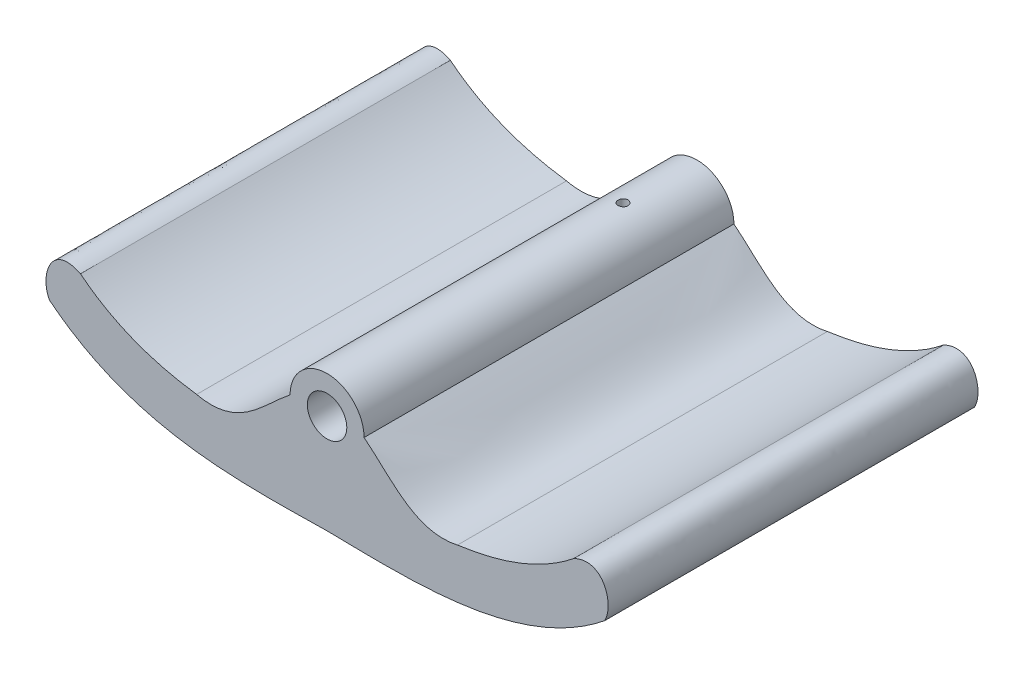
from build123d import *

# Parameters (mm, degrees)
SKETCH1_R           = 4
BOSS_EXTRUDE1_DEPTH = 75
SKETCH2_R           = 1
CUT_EXTRUDE1_DEPTH  = 75


with BuildPart() as part:
    # Sketch1 → Boss-Extrude1 (new body)
    with BuildSketch(Plane.XY):
        with BuildLine():
            ThreePointArc((7.5, 0), (0, 7.5), (-7.5, 0))
            add(Edge.make_bspline(
                [(-7.5, 0), (-13.133413819, -4.461912435), (-17.767441975, -11.345900192), (-26.448408985, -9.404150694)],
                knots=[0, 0, 0, 0, 1, 1, 1, 1], degree=3))
            add(Edge.make_bspline(
                [(-26.448408985, -9.404150694), (-34.892519394, -8.241593996), (-42.998591866, -5.63640498), (-50, 0)],
                knots=[0.508532521, 0.508532521, 0.508532521, 0.508532521, 1, 1, 1, 1], degree=3))
            add(Edge.make_bspline(
                [(-56.270853764, -7.789505316), (-58.317034017, -4.120672935), (-55.963516082, 2.956586768), (-50, 0)],
                knots=[0, 0, 0, 0, 1, 1, 1, 1], degree=3))
            add(Edge.make_bspline(
                [(0, -20.140225697), (-1.00593636, -20.15524797), (-3.047640759, -20.191257315), (-7.361898098, -20.266311816), (-13.006626751, -20.313476944), (-20.051108834, -20.120955208), (-27.291030951, -19.487291375), (-34.664372738, -18.197237521), (-42.077214845, -16.015044344), (-48.172992704, -13.24242478), (-52.871586187, -10.367033149), (-55.170435724, -8.6753845), (-56.270853764, -7.789505316)],
                knots=[0.002895243, 0.002895243, 0.002895243, 0.002895243, 0.0625, 0.125, 0.25, 0.375, 0.5, 0.625, 0.75, 0.875, 0.9375, 1, 1, 1, 1], degree=3))
            add(Edge.make_bspline(
                [(0, -20.140225697), (1.00593636, -20.15524797), (3.047640759, -20.191257315), (7.361898098, -20.266311816), (13.006626751, -20.313476944), (20.051108834, -20.120955208), (27.291030951, -19.487291375), (34.664372738, -18.197237521), (42.077214845, -16.015044344), (48.172992704, -13.24242478), (52.871586187, -10.367033149), (55.170435724, -8.6753845), (56.270853764, -7.789505316)],
                knots=[0.002895243, 0.002895243, 0.002895243, 0.002895243, 0.0625, 0.125, 0.25, 0.375, 0.5, 0.625, 0.75, 0.875, 0.9375, 1, 1, 1, 1], degree=3))
            add(Edge.make_bspline(
                [(56.270853764, -7.789505316), (58.317034017, -4.120672935), (55.963516082, 2.956586768), (50, 0)],
                knots=[0, 0, 0, 0, 1, 1, 1, 1], degree=3))
            add(Edge.make_bspline(
                [(26.448408985, -9.404150694), (34.892519394, -8.241593996), (42.998591866, -5.63640498), (50, 0)],
                knots=[0.508532521, 0.508532521, 0.508532521, 0.508532521, 1, 1, 1, 1], degree=3))
            add(Edge.make_bspline(
                [(26.448408985, -9.404150694), (17.767441975, -11.345900192), (13.133413819, -4.461912435), (7.5, 0)],
                knots=[0.885469804, 0.885469804, 0.885469804, 0.885469804, 1.885469804, 1.885469804, 1.885469804, 1.885469804], degree=3))
        make_face()
        Circle(SKETCH1_R, mode=Mode.SUBTRACT)
    extrude(amount=BOSS_EXTRUDE1_DEPTH)

    # Sketch2 → Cut-Extrude1 (cut)
    with BuildSketch(Plane(origin=(0, 0, 0), x_dir=(1, 0, 0), z_dir=(0, 1, 0))):
        with Locations(Location((0, -15, 0), (0, 0, 90))):
            Circle(SKETCH2_R)
    extrude(amount=CUT_EXTRUDE1_DEPTH, mode=Mode.SUBTRACT)


solid = part.part
